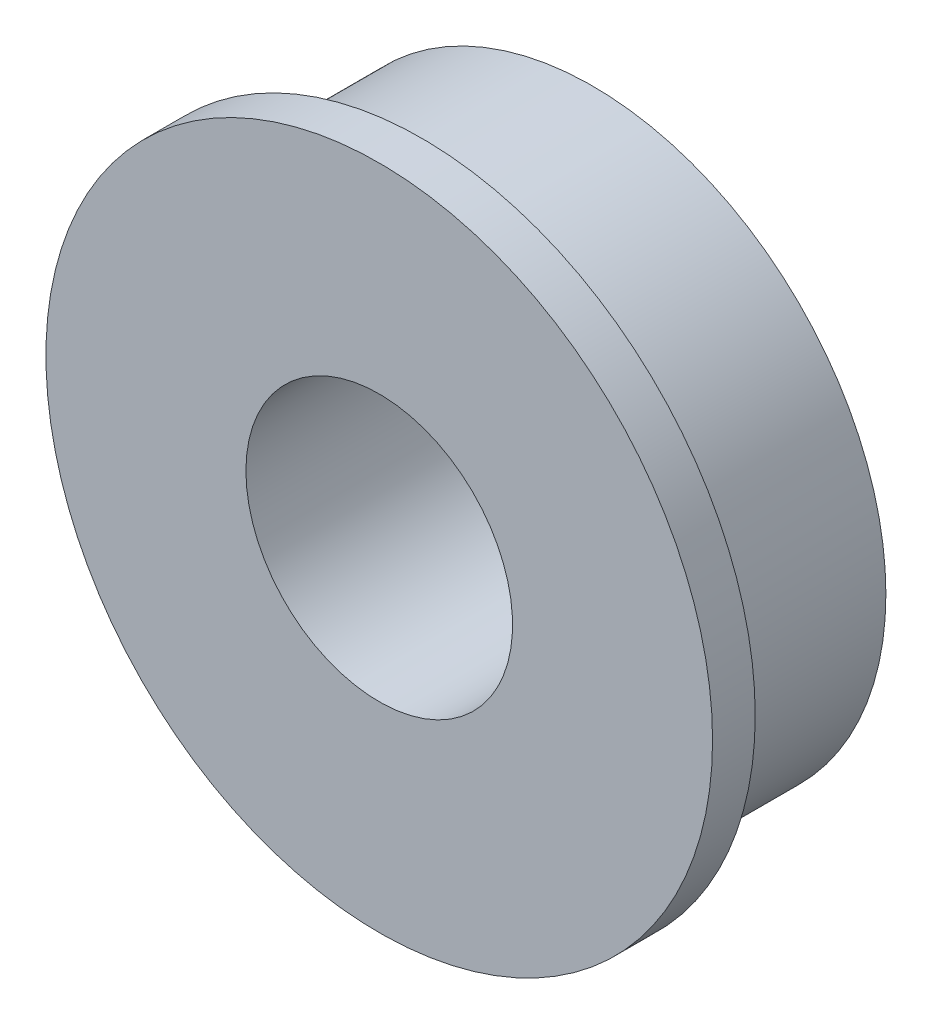
from build123d import *

# Parameters (mm, degrees)
SKETCH_1_R          = 5.5
EXTRUDE_1_DEPTH     = 4
SKETCH_2_R          = 6.25
EXTRUDE_2_DEPTH     = 0.8
SKETCH_3_R          = 2.5
CUT_EXTRUDE_1_DEPTH = 10.701803956


with BuildPart() as part:
    # 草图1 → 凸台-拉伸1 (new body)
    with BuildSketch(Plane.XY):
        Circle(SKETCH_1_R)
    extrude(amount=EXTRUDE_1_DEPTH)

    # 草图2 → 凸台-拉伸2 (add)
    with BuildSketch(Plane.XY.offset(4)):
        Circle(SKETCH_2_R)
    extrude(amount=-EXTRUDE_2_DEPTH)

    # 草图3 → 切除-拉伸1 (cut, through all)
    with BuildSketch(Plane(origin=(0, 0, 0), x_dir=(-1, 0, 0), z_dir=(0, 0, -1))):
        Circle(SKETCH_3_R)
    extrude(amount=-CUT_EXTRUDE_1_DEPTH, mode=Mode.SUBTRACT)


solid = part.part
